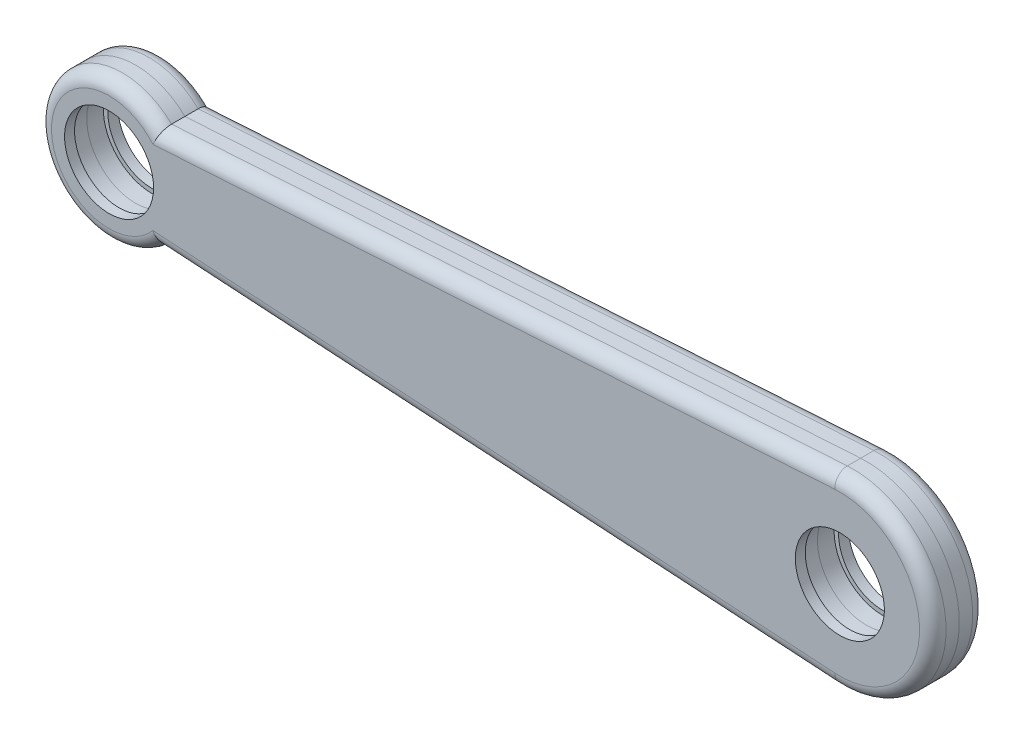
from build123d import *

# Parameters (mm, degrees)
BOSS_EXTRUDE1_DEPTH     = 6
SKETCH6_30_R            = 11.05
CUT_EXTRUDE1_DEPTH      = 3.75
CUT_EXTRUDE2_DEPTH      = 188.27786842
CUT_EXTRUDE2_DEPTH_BACK = 188.27786842
SKETCH6_31_R            = 10.05
CUT_EXTRUDE4_DEPTH      = 5.25
FILLET1_R               = 3


with BuildPart() as part:
    # Sketch6 → Boss-Extrude1 (new, symmetric)
    with BuildSketch(Plane.XY):
        with BuildLine():
            Line((11.124297731, -11.5), (163.700491182, -20.95975374))
            ThreePointArc((163.700491182, -20.95975374), (186, 0), (163.700491182, 20.95975374))
            Line((163.700491182, 20.95975374), (11.124297731, 11.5))
            ThreePointArc((11.124297731, 11.5), (-16, 0), (11.124297731, -11.5))
        make_face()
    extrude(amount=BOSS_EXTRUDE1_DEPTH, both=True)

    # Sketch6<30> → Cut-Extrude1 (cut, symmetric)
    with BuildSketch(Plane.XY):
        Circle(SKETCH6_30_R)
        with Locations((165, 0)):
            Circle(SKETCH6_30_R)
    extrude(amount=CUT_EXTRUDE1_DEPTH, both=True, mode=Mode.SUBTRACT)

    # Sketch6<31> → Cut-Extrude2 (cut, two sides: drawn at the far end of the back side and taken through both)
    with BuildSketch(Plane.XY.offset(-CUT_EXTRUDE2_DEPTH_BACK)):
        Circle(SKETCH6_31_R)
        with Locations((165, 0)):
            Circle(SKETCH6_31_R)
    extrude(amount=CUT_EXTRUDE2_DEPTH + CUT_EXTRUDE2_DEPTH_BACK, mode=Mode.SUBTRACT)

    # Sketch6<34> → Cut-Extrude4 (cut, symmetric)
    with BuildSketch(Plane.XY):
        Polygon((13.466970251, 8.639485647), (153.090211466, 17.296153823), (153.152092838, 16.298070312), (13.528851624, 7.641402136), align=None)
        Polygon((153.090211466, -17.296153823), (153.152092838, -16.298070312), (13.528851624, -7.641402136), (13.466970251, -8.639485647), align=None)
    extrude(amount=CUT_EXTRUDE4_DEPTH, both=True, mode=Mode.SUBTRACT)

    # Fillet1
    fillet1_edges = [part.edges().sort_by_distance(p)[0] for p in [
        (186, 0, 6),
        (186, 0, -6),
        (87.412394456, -16.22987687, 6),
        (-16, 0, 6),
        (87.412394456, 16.22987687, 6),
        (-16, 0, -6),
        (87.412394456, -16.22987687, -6),
        (87.412394456, 16.22987687, -6),
    ]]
    fillet(fillet1_edges, radius=FILLET1_R)


with BuildPart() as body_2:
    # Split1: the piece on the far side of the plane
    add(part.part)
    split(bisect_by=Plane.XY, keep=Keep.BOTTOM)


with BuildPart() as part_1:
    add(part.part)

    # Split1
    split(bisect_by=Plane.XY, keep=Keep.TOP)


solid = Compound([body_2.part, part_1.part])
